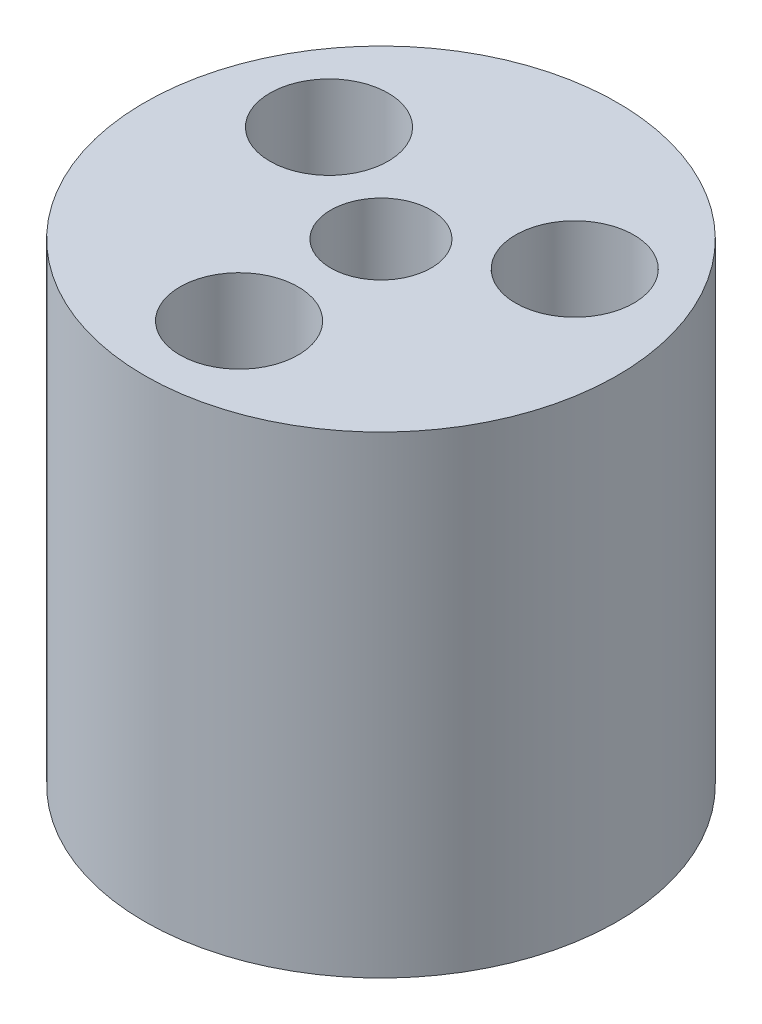
from build123d import *

# Parameters (mm, degrees)
SKETCH1_R           = 10
BOSS_EXTRUDE1_DEPTH = 20
SKETCH2_R           = 2.5
CUT_EXTRUDE1_DEPTH  = 10
SKETCH2_3_R         = 2.125
CUT_EXTRUDE2_DEPTH  = 25.494897428


with BuildPart() as part:
    # Sketch1 → Boss-Extrude1 (new body)
    with BuildSketch(Plane(origin=(0, 0, 0), x_dir=(1, 0, 0), z_dir=(0, 1, 0))):
        Circle(SKETCH1_R)
    extrude(amount=BOSS_EXTRUDE1_DEPTH)

    # Sketch2 → Cut-Extrude1 (cut)
    with BuildSketch(Plane(origin=(0, 20, 0), x_dir=(1, 0, 0), z_dir=(0, 1, 0))):
        with Locations((0, -6)):
            Circle(SKETCH2_R)
        with Locations((-5.196152423, 3)):
            Circle(SKETCH2_R)
        with Locations((5.196152423, 3)):
            Circle(SKETCH2_R)
    extrude(amount=-CUT_EXTRUDE1_DEPTH, mode=Mode.SUBTRACT)

    # Sketch2<3> → Cut-Extrude2 (cut, through all)
    with BuildSketch(Plane(origin=(0, 20, 0), x_dir=(1, 0, 0), z_dir=(0, 1, 0))):
        Circle(SKETCH2_3_R)
    extrude(amount=-CUT_EXTRUDE2_DEPTH, mode=Mode.SUBTRACT)


solid = part.part
